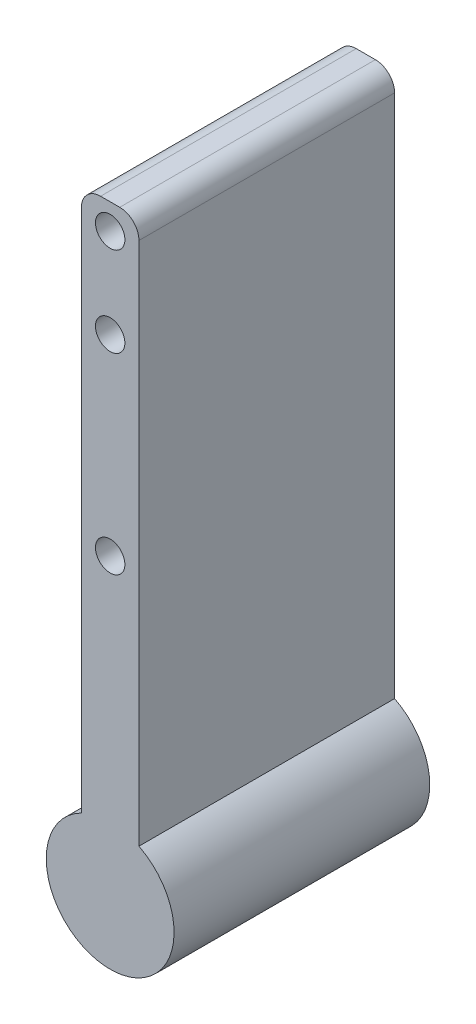
from build123d import *

# Parameters (mm, degrees)
SKETCH_1_R      = 5
SKETCH_1_W      = 4.5
SKETCH_1_H      = 47
SKETCH_1_R_2    = 1.15
EXTRUDE_1_DEPTH = 10
FILLET_1_R      = 1.5


with BuildPart() as part:
    # 草图1 → 凸台-拉伸1 (new, symmetric)
    # profile 1 of 2: a face of its own
    with BuildSketch(Plane.XY):
        with Locations((0, -23.5)):
            Circle(SKETCH_1_R)
    # profile 2 of 2: a face of its own
    with BuildSketch(Plane.XY):
        Rectangle(SKETCH_1_W, SKETCH_1_H)
        with Locations((0, -0.5)):
            Circle(SKETCH_1_R_2, mode=Mode.SUBTRACT)
        with Locations((0, 14.5)):
            Circle(SKETCH_1_R_2, mode=Mode.SUBTRACT)
        with Locations((0, 21.5)):
            Circle(SKETCH_1_R_2, mode=Mode.SUBTRACT)
    extrude(amount=EXTRUDE_1_DEPTH, both=True)

    # 圆角1
    fillet_1_edges = [part.edges().sort_by_distance(p)[0] for p in [
        (-2.25, 23.5, 0),
        (2.25, 23.5, 0),
    ]]
    fillet(fillet_1_edges, radius=FILLET_1_R)


solid = part.part
